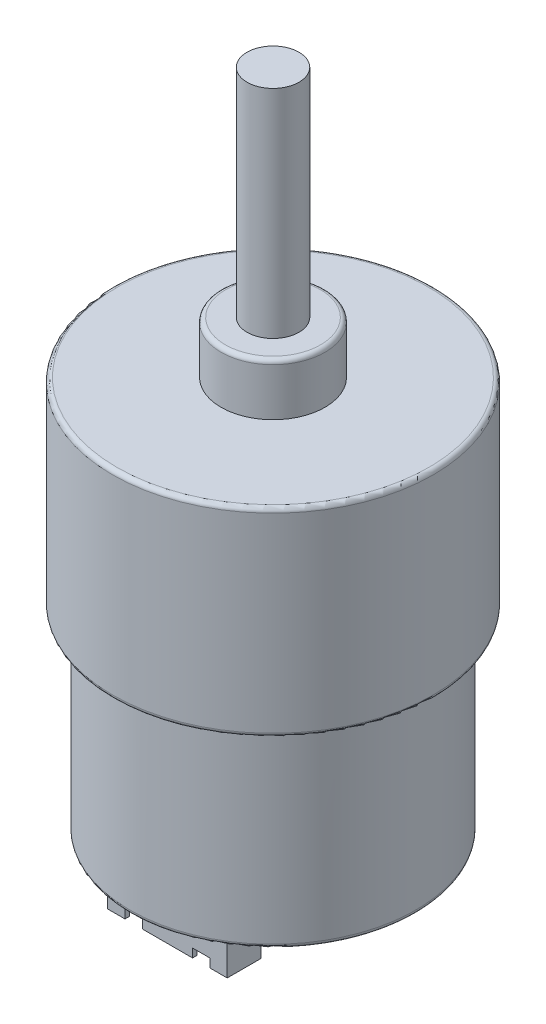
from build123d import *

# Parameters (mm, degrees)
SKETCH1_R           = 16.5
BOSS_EXTRUDE1_DEPTH = 22.5
SKETCH2_R           = 18.5
BOSS_EXTRUDE2_DEPTH = 23
SKETCH3_R           = 6
BOSS_EXTRUDE3_DEPTH = 6
SKETCH4_R           = 3
BOSS_EXTRUDE4_DEPTH = 25
FILLET4_R           = 0.5
FILLET5_R           = 0.5
FILLET6_R           = 0.5
FILLET7_R           = 0.5
SKETCH9_R           = 5
BOSS_EXTRUDE5_DEPTH = 2
SKETCH10_R          = 1
BOSS_EXTRUDE6_DEPTH = 1
SKETCH11_W          = 13.803464896
SKETCH11_H          = 3.909651907
SKETCH11_W_2        = 12.803464896
SKETCH11_H_2        = 2.909651907
BOSS_EXTRUDE7_DEPTH = 5
SKETCH12_W          = 2
SKETCH12_H          = 1
CUT_EXTRUDE5_DEPTH  = 2
SKETCH13_W          = 0.5
SKETCH13_H          = 0.5
BOSS_EXTRUDE8_DEPTH = 4


with BuildPart() as part:
    # Sketch1 → Boss-Extrude1 (new body)
    with BuildSketch(Plane(origin=(0, 0, 0), x_dir=(1, 0, 0), z_dir=(0, 1, 0))):
        with Locations(Location((0, 0, 0), (0, 0, 90))):
            Circle(SKETCH1_R)
    extrude(amount=BOSS_EXTRUDE1_DEPTH)

    # Sketch2 → Boss-Extrude2 (add)
    with BuildSketch(Plane(origin=(0, 22.5, 0), x_dir=(1, 0, 0), z_dir=(0, 1, 0))):
        with Locations(Location((0, 0, 0), (0, 0, 270))):
            Circle(SKETCH2_R)
    extrude(amount=BOSS_EXTRUDE2_DEPTH)

    # Sketch3 → Boss-Extrude3 (add)
    with BuildSketch(Plane(origin=(0, 45.5, 0), x_dir=(1, 0, 0), z_dir=(0, 1, 0))):
        with Locations(Location((0, 0.01, 0), (0, 0, 270))):
            Circle(SKETCH3_R)
    extrude(amount=BOSS_EXTRUDE3_DEPTH)

    # Sketch4 → Boss-Extrude4 (add)
    with BuildSketch(Plane(origin=(0, 51.5, 0), x_dir=(1, 0, 0), z_dir=(0, 1, 0))):
        with Locations(Location((0, 0.01, 0), (0, 0, 270))):
            Circle(SKETCH4_R)
    extrude(amount=BOSS_EXTRUDE4_DEPTH)

    # Fillet4
    fillet4_edges = [part.edges().sort_by_distance(p)[0] for p in [
        (0, 22.5, -18.5),
    ]]
    fillet(fillet4_edges, radius=FILLET4_R)

    # Fillet5
    fillet5_edges = [part.edges().sort_by_distance(p)[0] for p in [
        (0, 0, 16.5),
    ]]
    fillet(fillet5_edges, radius=FILLET5_R)

    # Fillet6
    fillet6_edges = [part.edges().sort_by_distance(p)[0] for p in [
        (0, 45.5, -18.5),
    ]]
    fillet(fillet6_edges, radius=FILLET6_R)

    # Fillet7
    fillet7_edges = [part.edges().sort_by_distance(p)[0] for p in [
        (0, 51.5, -6.01),
    ]]
    fillet(fillet7_edges, radius=FILLET7_R)

    # Sketch9 → Boss-Extrude5 (add)
    with BuildSketch(Plane.XZ):
        with Locations(Location((0, 0, 0), (0, 0, 90))):
            Circle(SKETCH9_R)
    extrude(amount=BOSS_EXTRUDE5_DEPTH)

    # Sketch10 → Boss-Extrude6 (add)
    with BuildSketch(Plane.XZ.offset(2)):
        with Locations(Location((0, 0, 0), (0, 0, 270))):
            Circle(SKETCH10_R)
    extrude(amount=BOSS_EXTRUDE6_DEPTH)

    # Sketch11 → Boss-Extrude7 (add)
    with BuildSketch(Plane.XZ):
        with Locations((0, 10.224361626)):
            Rectangle(SKETCH11_W, SKETCH11_H)
        with Locations((0, 10.224361626)):
            Rectangle(SKETCH11_W_2, SKETCH11_H_2, mode=Mode.SUBTRACT)
    extrude(amount=BOSS_EXTRUDE7_DEPTH)

    # Sketch12 → Cut-Extrude5 (cut)
    with BuildSketch(Plane.XY.offset(12.179187579)):
        with Locations((-3.901732448, -4.5)):
            Rectangle(SKETCH12_W, SKETCH12_H)
        with Locations((3.901732448, -4.5)):
            Rectangle(SKETCH12_W, SKETCH12_H)
    extrude(amount=-CUT_EXTRUDE5_DEPTH, mode=Mode.SUBTRACT)

    # Sketch13 → Boss-Extrude8 (add)
    with BuildSketch(Plane.XZ):
        with Locations((-4.651732448, 10.224361626)):
            Rectangle(SKETCH13_W, SKETCH13_H)
        with Locations((-1.651732448, 10.224361626)):
            Rectangle(SKETCH13_W, SKETCH13_H)
        with Locations((1.348267552, 10.224361626)):
            Rectangle(SKETCH13_W, SKETCH13_H)
        with Locations((4.348267552, 10.224361626)):
            Rectangle(SKETCH13_W, SKETCH13_H)
    extrude(amount=BOSS_EXTRUDE8_DEPTH)


solid = part.part
